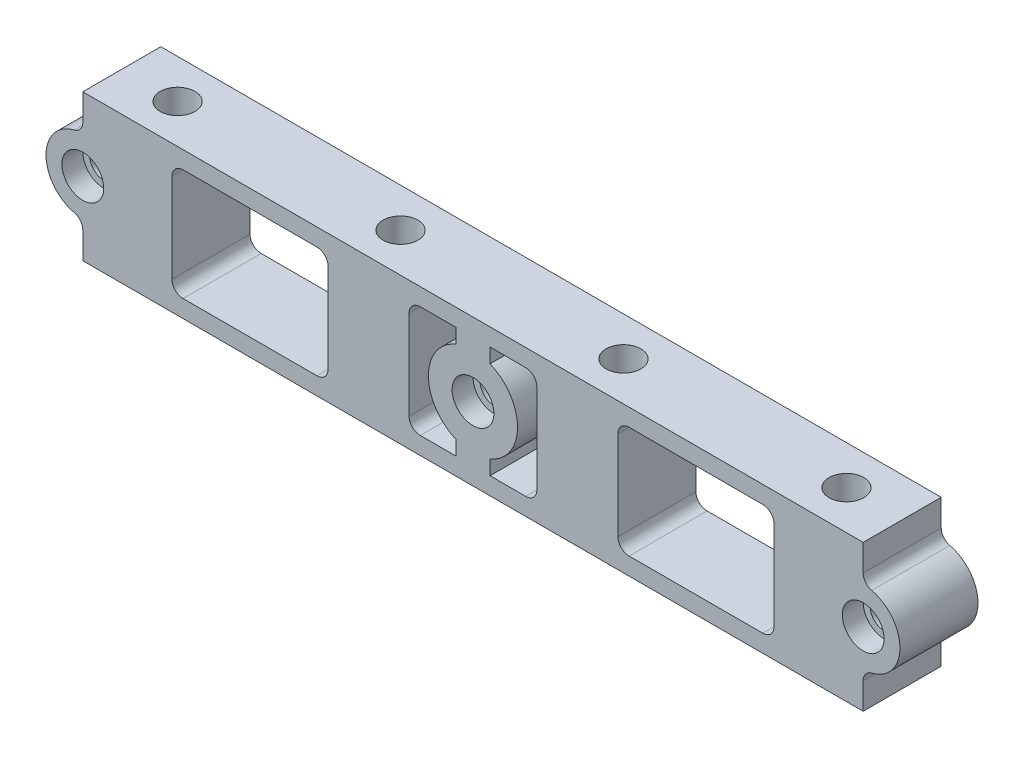
from build123d import *

# Parameters (mm, degrees)
SKETCH1_W           = 195.2625
SKETCH1_H           = 33.3375
SKETCH1_R           = 3.175
BOSS_EXTRUDE1_DEPTH = 17.78
SKETCH2_R           = 3.96875
CUT_EXTRUDE1_DEPTH  = 33.3375
SKETCH3_R           = 4.7625
CUT_EXTRUDE2_DEPTH  = 4.7752
CUT_EXTRUDE3_DEPTH  = 17.78


with BuildPart() as part:
    # Sketch1 → Boss-Extrude1 (new body)
    with BuildSketch(Plane.XY):
        with Locations((-88.9, 0)):
            Rectangle(SKETCH1_W, SKETCH1_H)
        Circle(SKETCH1_R, mode=Mode.SUBTRACT)
        with Locations((-177.8, 0)):
            Circle(SKETCH1_R, mode=Mode.SUBTRACT)
        with Locations((-88.9, 0)):
            Circle(SKETCH1_R, mode=Mode.SUBTRACT)
    extrude(amount=-BOSS_EXTRUDE1_DEPTH)

    # Sketch2 → Cut-Extrude1 (cut)
    with BuildSketch(Plane(origin=(0, 16.66875, 0), x_dir=(1, 0, 0), z_dir=(0, 1, 0))):
        with Locations(Location((-12.7, 8.89, 0), (0, 0, 270))):
            Circle(SKETCH2_R)
        with Locations(Location((-63.5, 8.89, 0), (0, 0, 270))):
            Circle(SKETCH2_R)
        with Locations(Location((-114.3, 8.89, 0), (0, 0, 270))):
            Circle(SKETCH2_R)
        with Locations(Location((-165.1, 8.89, 0), (0, 0, 270))):
            Circle(SKETCH2_R)
    extrude(amount=-CUT_EXTRUDE1_DEPTH, mode=Mode.SUBTRACT)

    # Sketch3 → Cut-Extrude2 (cut)
    with BuildSketch(Plane.XY):
        Circle(SKETCH3_R)
        with Locations((-88.9, 0)):
            Circle(SKETCH3_R)
        with Locations((-177.8, 0)):
            Circle(SKETCH3_R)
    extrude(amount=-CUT_EXTRUDE2_DEPTH, mode=Mode.SUBTRACT)

    # Sketch5 → Cut-Extrude3 (cut)
    with BuildSketch(Plane.XY):
        with BuildLine():
            Line((0, -16.66875), (8.73125, -16.66875))
            Line((8.73125, -16.66875), (8.73125, 16.66875))
            Line((8.73125, 16.66875), (0, 16.66875))
            Line((0, 16.66875), (0, 10.622546022))
            ThreePointArc((0, 10.622546022), (0.546012526, 9.049137635), (1.949302326, 8.152186482))
            ThreePointArc((1.949302326, 8.152186482), (8.382, 0), (1.949302326, -8.152186482))
            ThreePointArc((1.949302326, -8.152186482), (0.546012526, -9.049137635), (0, -10.622546022))
            Line((0, -10.622546022), (0, -16.66875))
        make_face()
        with BuildLine():
            Line((-22.86, -12.7), (-53.34, -12.7))
            ThreePointArc((-53.34, -12.7), (-55.136051224, -11.956051224), (-55.88, -10.16))
            Line((-55.88, -10.16), (-55.88, 10.16))
            ThreePointArc((-55.88, 10.16), (-55.136051224, 11.956051224), (-53.34, 12.7))
            Line((-53.34, 12.7), (-22.86, 12.7))
            ThreePointArc((-22.86, 12.7), (-21.063948776, 11.956051224), (-20.32, 10.16))
            Line((-20.32, 10.16), (-20.32, -10.16))
            ThreePointArc((-20.32, -10.16), (-21.063948776, -11.956051224), (-22.86, -12.7))
        make_face()
        with BuildLine():
            Line((-85.011936327, -9.38661605), (-85.011936327, -12.7))
            Line((-85.011936327, -12.7), (-76.883936327, -12.7))
            ThreePointArc((-76.883936327, -12.7), (-75.087885103, -11.956051224), (-74.343936327, -10.16))
            Line((-74.343936327, -10.16), (-74.343936327, 10.16))
            ThreePointArc((-74.343936327, 10.16), (-75.087885103, 11.956051224), (-76.883936327, 12.7))
            Line((-76.883936327, 12.7), (-85.011936327, 12.7))
            Line((-85.011936327, 12.7), (-85.011936327, 9.38661605))
            ThreePointArc((-85.011936327, 9.38661605), (-78.74, 0), (-85.011936327, -9.38661605))
        make_face()
        with BuildLine():
            Line((-100.916063673, 12.7), (-92.788063673, 12.7))
            Line((-92.788063673, 12.7), (-92.788063673, 9.38661605))
            ThreePointArc((-92.788063673, 9.38661605), (-99.06, 0), (-92.788063673, -9.38661605))
            Line((-92.788063673, -9.38661605), (-92.788063673, -12.7))
            Line((-92.788063673, -12.7), (-100.916063673, -12.7))
            ThreePointArc((-100.916063673, -12.7), (-102.712114897, -11.956051224), (-103.456063673, -10.16))
            Line((-103.456063673, -10.16), (-103.456063673, 10.16))
            ThreePointArc((-103.456063673, 10.16), (-102.712114897, 11.956051224), (-100.916063673, 12.7))
        make_face()
        with BuildLine():
            Line((-154.94, 12.7), (-124.46, 12.7))
            ThreePointArc((-124.46, 12.7), (-122.663948776, 11.956051224), (-121.92, 10.16))
            Line((-121.92, 10.16), (-121.92, -10.16))
            ThreePointArc((-121.92, -10.16), (-122.663948776, -11.956051224), (-124.46, -12.7))
            Line((-124.46, -12.7), (-154.94, -12.7))
            ThreePointArc((-154.94, -12.7), (-156.736051224, -11.956051224), (-157.48, -10.16))
            Line((-157.48, -10.16), (-157.48, 10.16))
            ThreePointArc((-157.48, 10.16), (-156.736051224, 11.956051224), (-154.94, 12.7))
        make_face()
        with BuildLine():
            Line((-186.53125, -16.66875), (-186.53125, 16.66875))
            Line((-186.53125, 16.66875), (-177.8, 16.66875))
            Line((-177.8, 16.66875), (-177.8, 10.622546022))
            ThreePointArc((-177.8, 10.622546022), (-178.346012526, 9.049137635), (-179.749302326, 8.152186482))
            ThreePointArc((-179.749302326, 8.152186482), (-186.182, 0), (-179.749302326, -8.152186482))
            ThreePointArc((-179.749302326, -8.152186482), (-178.346012526, -9.049137635), (-177.8, -10.622546022))
            Line((-177.8, -10.622546022), (-177.8, -16.66875))
            Line((-177.8, -16.66875), (-186.53125, -16.66875))
        make_face()
    extrude(amount=-CUT_EXTRUDE3_DEPTH, mode=Mode.SUBTRACT)


solid = part.part
